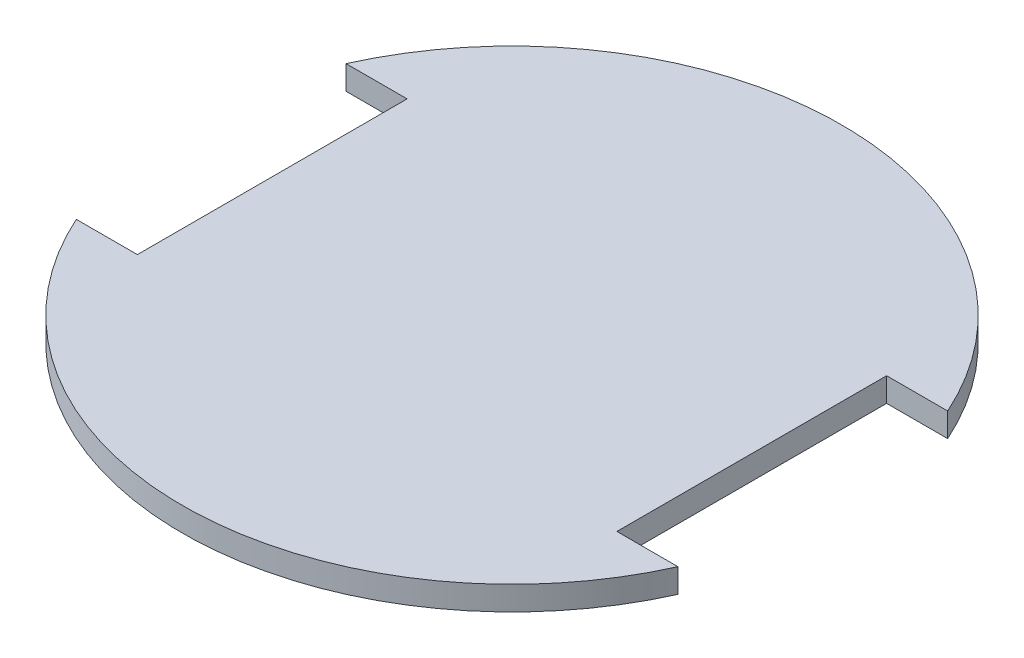
from build123d import *

# Parameters (mm, degrees)
BOSS_EXTRU_1_DEPTH = 8


with BuildPart() as part:
    # Esquisse1 → Boss.-Extru.1 (new body)
    with BuildSketch(Plane(origin=(0, 0, 0), x_dir=(1, 0, 0), z_dir=(0, 1, 0))):
        with BuildLine():
            Line((-80, 45), (-80, -45))
            Line((-80, -45), (-100.374299499, -45))
            ThreePointArc((-100.374299499, -45), (0, -110), (100.374299499, -45))
            Line((100.374299499, -45), (80, -45))
            Line((80, -45), (80, 45))
            Line((80, 45), (100.374299499, 45))
            ThreePointArc((100.374299499, 45), (0, 110), (-100.374299499, 45))
            Line((-100.374299499, 45), (-80, 45))
        make_face()
    extrude(amount=BOSS_EXTRU_1_DEPTH)


solid = part.part
